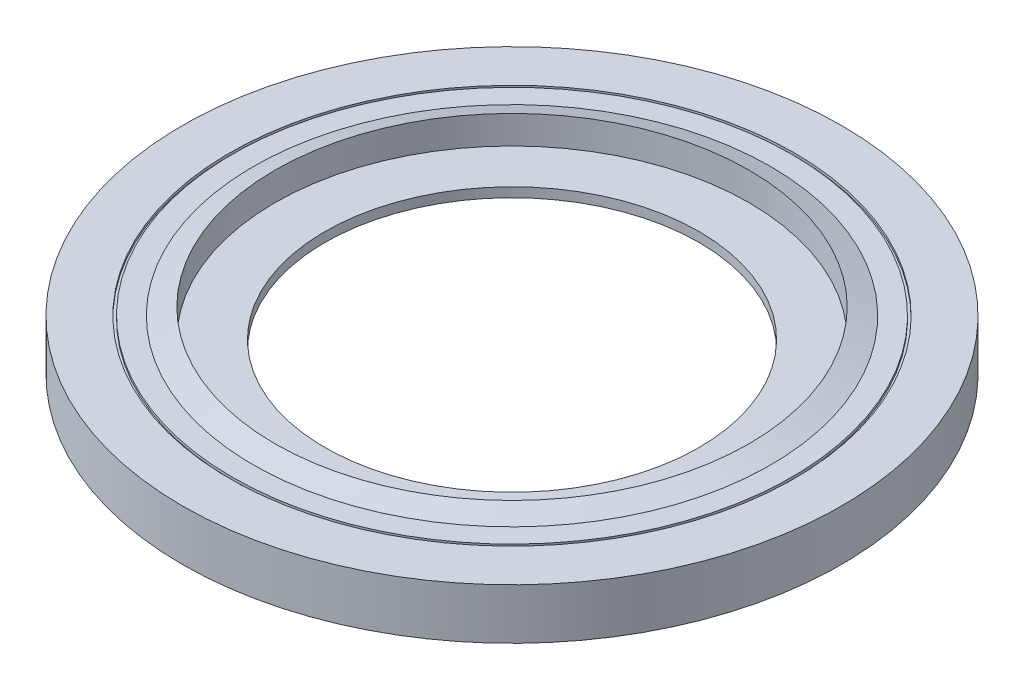
from build123d import *


with BuildPart() as part:
    # Sketch1 → Revolve1 (revolve)
    with BuildSketch(Plane.XY):
        Polygon((7.38, -0.1875), (7.38, 0.1875), (9.35, 0.1875), (9.35, 1.3), (10.2, 1), (11.033333333, 1), (11.033333333, 0.9), (11.133333333, 0.9), (11.133333333, 1), (13, 1), (13, -1), (11.133333333, -1), (11.133333333, -0.9), (11.033333333, -0.9), (11.033333333, -1), (10.2, -1), (9.35, -1.3), (9.35, -0.1875), align=None)
    revolve(axis=Axis((0, 0, 0), (0, 1, 0)))


solid = part.part
